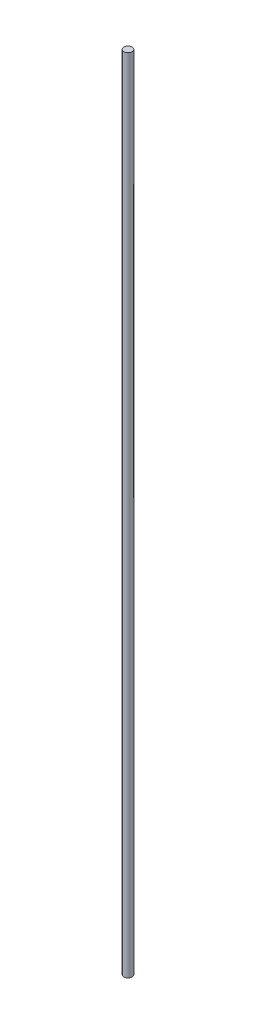
from build123d import *

# Parameters (mm, degrees)
SKETCH1_R           = 3.175
BOSS_EXTRUDE1_DEPTH = 617.22


with BuildPart() as part:
    # Sketch1 → Boss-Extrude1 (new body)
    with BuildSketch(Plane(origin=(0, 0, 0), x_dir=(1, 0, 0), z_dir=(0, 1, 0))):
        with Locations(Location((0, 0, 0), (0, 0, 270))):
            Circle(SKETCH1_R)
    extrude(amount=BOSS_EXTRUDE1_DEPTH)


solid = part.part
